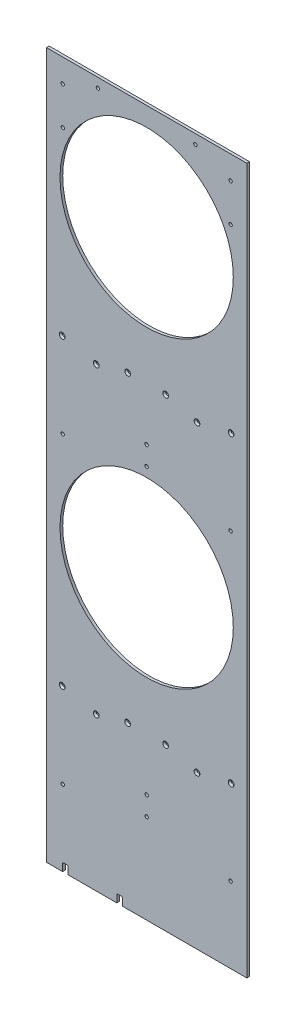
from build123d import *

# Parameters (mm, degrees)
SKETCH1_W                                     = 469.9
SKETCH1_H                                     = 2413
SKETCH1_R                                     = 203.2
BOSS_EXTRUDE1_DEPTH                           = 6.35
CSK_FOR_1_4_FLAT_HEAD_SOCKET_CAP_SCR_2_COUNT  = 2
CSK_FOR_1_4_FLAT_HEAD_SOCKET_CAP_SCR_2_PITCH  = 76.2
CSK_FOR_1_4_FLAT_HEAD_SOCKET_CAP_SCR_3_COUNT  = 2
CSK_FOR_1_4_FLAT_HEAD_SOCKET_CAP_SCR_3_PITCH  = 89.142542345
CSK_FOR_1_4_FLAT_HEAD_SOCKET_CAP_SCR_4_COUNT  = 2
CSK_FOR_1_4_FLAT_HEAD_SOCKET_CAP_SCR_4_PITCH  = 163.936718394
CSK_FOR_1_4_FLAT_HEAD_SOCKET_CAP_SCR_5_COUNT  = 2
CSK_FOR_1_4_FLAT_HEAD_SOCKET_CAP_SCR_5_PITCH  = 711.2
CSK_FOR_1_4_FLAT_HEAD_SOCKET_CAP_SCR_6_COUNT  = 2
CSK_FOR_1_4_FLAT_HEAD_SOCKET_CAP_SCR_6_PITCH  = 695.384275934
CSK_FOR_1_4_FLAT_HEAD_SOCKET_CAP_SCR_7_COUNT  = 2
CSK_FOR_1_4_FLAT_HEAD_SOCKET_CAP_SCR_7_PITCH  = 716.764837904
CSK_FOR_1_4_FLAT_HEAD_SOCKET_CAP_SCR_8_COUNT  = 2
CSK_FOR_1_4_FLAT_HEAD_SOCKET_CAP_SCR_8_PITCH  = 710.371803251
CSK_FOR_1_4_FLAT_HEAD_SOCKET_CAP_SCR_9_COUNT  = 2
CSK_FOR_1_4_FLAT_HEAD_SOCKET_CAP_SCR_9_PITCH  = 1422.4
CSK_FOR_1_4_FLAT_HEAD_SOCKET_CAP_SCR_10_COUNT = 2
CSK_FOR_1_4_FLAT_HEAD_SOCKET_CAP_SCR_10_PITCH = 1404.60778242
CSK_FOR_1_4_FLAT_HEAD_SOCKET_CAP_SCR_11_COUNT = 2
CSK_FOR_1_4_FLAT_HEAD_SOCKET_CAP_SCR_11_PITCH = 1425.190567207
CSK_FOR_1_4_FLAT_HEAD_SOCKET_CAP_SCR_12_COUNT = 2
CSK_FOR_1_4_FLAT_HEAD_SOCKET_CAP_SCR_12_PITCH = 1412.087755797
CSK_FOR_1_4_FLAT_HEAD_SOCKET_CAP_SCR_13_COUNT = 2
CSK_FOR_1_4_FLAT_HEAD_SOCKET_CAP_SCR_13_PITCH = 153.55813077
CSK_FOR_1_4_FLAT_HEAD_SOCKET_CAP_SCR_14_COUNT = 2
CSK_FOR_1_4_FLAT_HEAD_SOCKET_CAP_SCR_14_PITCH = 242.697219812
CSK_FOR_1_4_FLAT_HEAD_SOCKET_CAP_SCR_15_COUNT = 2
CSK_FOR_1_4_FLAT_HEAD_SOCKET_CAP_SCR_15_PITCH = 749.86024568
CSK_FOR_1_4_FLAT_HEAD_SOCKET_CAP_SCR_16_COUNT = 2
CSK_FOR_1_4_FLAT_HEAD_SOCKET_CAP_SCR_16_PITCH = 1441.280581843
CSK_FOR_1_4_FLAT_HEAD_SOCKET_CAP_SCR_17_COUNT = 2
CSK_FOR_1_4_FLAT_HEAD_SOCKET_CAP_SCR_17_PITCH = 1428.974413563
CSK_FOR_1_4_FLAT_HEAD_SOCKET_CAP_SCR_18_COUNT = 2
CSK_FOR_1_4_FLAT_HEAD_SOCKET_CAP_SCR_18_PITCH = 725.925992834
F_5_16_0_3125_DIAMETER_HOLE1_D                = 7.9375
SKETCH6_W                                     = 469.9
SKETCH6_H                                     = 758.19
CUT_EXTRUDE1_DEPTH                            = 2425.419688297
SKETCH8_W                                     = 13.208
SKETCH8_H                                     = 19.05
CUT_EXTRUDE2_DEPTH                            = 1672.417949257
FILLET1_R                                     = 3.175


with BuildPart() as part:
    # Sketch1 → Boss-Extrude1 (new body)
    with BuildSketch(Plane.XY):
        with Locations((0, 1206.5)):
            Rectangle(SKETCH1_W, SKETCH1_H)
        with Locations((0, 695.96)):
            Circle(SKETCH1_R, mode=Mode.SUBTRACT)
        with Locations((0, 1407.16)):
            Circle(SKETCH1_R, mode=Mode.SUBTRACT)
        with Locations((0, 2118.36)):
            Circle(SKETCH1_R, mode=Mode.SUBTRACT)
    extrude(amount=BOSS_EXTRUDE1_DEPTH)

    # Sketch3 → CSK for 1/4 Flat Head Socket Cap Screw1 (revolve, cut)
    with BuildSketch(Plane(origin=(44.571271172, 378.545152647, 6.35), x_dir=(0, -1, 0), z_dir=(1, 0, 0))):
        Polygon((0, 0), (0, 6.35), (3.3782, 6.35), (3.3782, 3.871564875), (6.7437, 0), align=None)
    csk_for_1_4_flat_head_socket_cap_screw1 = revolve(axis=Axis((44.571271172, 378.545152647, 12.7), (0, 0, -1)), mode=Mode.SUBTRACT)

    # CSK for 1_4 Flat Head Socket Cap Scr 2: CSK for 1/4 Flat Head Socket Cap Screw1 ×2
    with Locations(*[Vector(0.9659258262890683, -0.2588190451025208, 0) * (i * CSK_FOR_1_4_FLAT_HEAD_SOCKET_CAP_SCR_2_PITCH) for i in range(1, CSK_FOR_1_4_FLAT_HEAD_SOCKET_CAP_SCR_2_COUNT)]):
        add(csk_for_1_4_flat_head_socket_cap_screw1, mode=Mode.SUBTRACT)

    # CSK for 1_4 Flat Head Socket Cap Scr 3: CSK for 1/4 Flat Head Socket Cap Screw1 ×2
    with Locations(*[(-i * CSK_FOR_1_4_FLAT_HEAD_SOCKET_CAP_SCR_3_PITCH, 0, 0) for i in range(1, CSK_FOR_1_4_FLAT_HEAD_SOCKET_CAP_SCR_3_COUNT)]):
        add(csk_for_1_4_flat_head_socket_cap_screw1, mode=Mode.SUBTRACT)

    # CSK for 1_4 Flat Head Socket Cap Scr 4: CSK for 1/4 Flat Head Socket Cap Screw1 ×2
    with Locations(*[Vector(-0.9927372702249053, -0.12030258644935032, 0) * (i * CSK_FOR_1_4_FLAT_HEAD_SOCKET_CAP_SCR_4_PITCH) for i in range(1, CSK_FOR_1_4_FLAT_HEAD_SOCKET_CAP_SCR_4_COUNT)]):
        add(csk_for_1_4_flat_head_socket_cap_screw1, mode=Mode.SUBTRACT)

    # CSK for 1_4 Flat Head Socket Cap Scr 5: CSK for 1/4 Flat Head Socket Cap Screw1 ×2
    with Locations(*[(0, i * CSK_FOR_1_4_FLAT_HEAD_SOCKET_CAP_SCR_5_PITCH, 0) for i in range(1, CSK_FOR_1_4_FLAT_HEAD_SOCKET_CAP_SCR_5_COUNT)]):
        add(csk_for_1_4_flat_head_socket_cap_screw1, mode=Mode.SUBTRACT)

    # CSK for 1_4 Flat Head Socket Cap Scr 6: CSK for 1/4 Flat Head Socket Cap Screw1 ×2
    with Locations(*[Vector(0.10584586179249755, 0.9943825488922277, 0) * (i * CSK_FOR_1_4_FLAT_HEAD_SOCKET_CAP_SCR_6_PITCH) for i in range(1, CSK_FOR_1_4_FLAT_HEAD_SOCKET_CAP_SCR_6_COUNT)]):
        add(csk_for_1_4_flat_head_socket_cap_screw1, mode=Mode.SUBTRACT)

    # CSK for 1_4 Flat Head Socket Cap Scr 7: CSK for 1/4 Flat Head Socket Cap Screw1 ×2
    with Locations(*[Vector(-0.12436790650262035, 0.9922361734144526, 0) * (i * CSK_FOR_1_4_FLAT_HEAD_SOCKET_CAP_SCR_7_PITCH) for i in range(1, CSK_FOR_1_4_FLAT_HEAD_SOCKET_CAP_SCR_7_COUNT)]):
        add(csk_for_1_4_flat_head_socket_cap_screw1, mode=Mode.SUBTRACT)

    # CSK for 1_4 Flat Head Socket Cap Scr 8: CSK for 1/4 Flat Head Socket Cap Screw1 ×2
    with Locations(*[Vector(-0.22909987356363595, 0.9734029216789553, 0) * (i * CSK_FOR_1_4_FLAT_HEAD_SOCKET_CAP_SCR_8_PITCH) for i in range(1, CSK_FOR_1_4_FLAT_HEAD_SOCKET_CAP_SCR_8_COUNT)]):
        add(csk_for_1_4_flat_head_socket_cap_screw1, mode=Mode.SUBTRACT)

    # CSK for 1_4 Flat Head Socket Cap Scr 9: CSK for 1/4 Flat Head Socket Cap Screw1 ×2
    with Locations(*[(0, i * CSK_FOR_1_4_FLAT_HEAD_SOCKET_CAP_SCR_9_PITCH, 0) for i in range(1, CSK_FOR_1_4_FLAT_HEAD_SOCKET_CAP_SCR_9_COUNT)]):
        add(csk_for_1_4_flat_head_socket_cap_screw1, mode=Mode.SUBTRACT)

    # CSK for 1_4 Flat Head Socket Cap Scr 10: CSK for 1/4 Flat Head Socket Cap Screw1 ×2
    with Locations(*[Vector(0.05240149519635648, 0.9986260978470302, 0) * (i * CSK_FOR_1_4_FLAT_HEAD_SOCKET_CAP_SCR_10_PITCH) for i in range(1, CSK_FOR_1_4_FLAT_HEAD_SOCKET_CAP_SCR_10_COUNT)]):
        add(csk_for_1_4_flat_head_socket_cap_screw1, mode=Mode.SUBTRACT)

    # CSK for 1_4 Flat Head Socket Cap Scr 11: CSK for 1/4 Flat Head Socket Cap Screw1 ×2
    with Locations(*[Vector(-0.06254780546262285, 0.9980419690733501, 0) * (i * CSK_FOR_1_4_FLAT_HEAD_SOCKET_CAP_SCR_11_PITCH) for i in range(1, CSK_FOR_1_4_FLAT_HEAD_SOCKET_CAP_SCR_11_COUNT)]):
        add(csk_for_1_4_flat_head_socket_cap_screw1, mode=Mode.SUBTRACT)

    # CSK for 1_4 Flat Head Socket Cap Scr 12: CSK for 1/4 Flat Head Socket Cap Screw1 ×2
    with Locations(*[Vector(-0.11525210783816901, 0.9933362731919434, 0) * (i * CSK_FOR_1_4_FLAT_HEAD_SOCKET_CAP_SCR_12_PITCH) for i in range(1, CSK_FOR_1_4_FLAT_HEAD_SOCKET_CAP_SCR_12_COUNT)]):
        add(csk_for_1_4_flat_head_socket_cap_screw1, mode=Mode.SUBTRACT)

    # CSK for 1_4 Flat Head Socket Cap Scr 13: CSK for 1/4 Flat Head Socket Cap Screw1 ×2
    with Locations(*[Vector(0.9999387727480229, -0.01106574693266877, 0) * (i * CSK_FOR_1_4_FLAT_HEAD_SOCKET_CAP_SCR_13_PITCH) for i in range(1, CSK_FOR_1_4_FLAT_HEAD_SOCKET_CAP_SCR_13_COUNT)]):
        add(csk_for_1_4_flat_head_socket_cap_screw1, mode=Mode.SUBTRACT)

    # CSK for 1_4 Flat Head Socket Cap Scr 14: CSK for 1/4 Flat Head Socket Cap Screw1 ×2
    with Locations(*[Vector(-0.9999754894630325, -0.007001462216473419, 0) * (i * CSK_FOR_1_4_FLAT_HEAD_SOCKET_CAP_SCR_14_PITCH) for i in range(1, CSK_FOR_1_4_FLAT_HEAD_SOCKET_CAP_SCR_14_COUNT)]):
        add(csk_for_1_4_flat_head_socket_cap_screw1, mode=Mode.SUBTRACT)

    # CSK for 1_4 Flat Head Socket Cap Scr 15: CSK for 1/4 Flat Head Socket Cap Screw1 ×2
    with Locations(*[Vector(-0.3236486699631256, 0.9461773292734824, 0) * (i * CSK_FOR_1_4_FLAT_HEAD_SOCKET_CAP_SCR_15_PITCH) for i in range(1, CSK_FOR_1_4_FLAT_HEAD_SOCKET_CAP_SCR_15_COUNT)]):
        add(csk_for_1_4_flat_head_socket_cap_screw1, mode=Mode.SUBTRACT)

    # CSK for 1_4 Flat Head Socket Cap Scr 16: CSK for 1/4 Flat Head Socket Cap Screw1 ×2
    with Locations(*[Vector(-0.16838586062272745, 0.9857211583111846, 0) * (i * CSK_FOR_1_4_FLAT_HEAD_SOCKET_CAP_SCR_16_PITCH) for i in range(1, CSK_FOR_1_4_FLAT_HEAD_SOCKET_CAP_SCR_16_COUNT)]):
        add(csk_for_1_4_flat_head_socket_cap_screw1, mode=Mode.SUBTRACT)

    # CSK for 1_4 Flat Head Socket Cap Scr 17: CSK for 1/4 Flat Head Socket Cap Screw1 ×2
    with Locations(*[Vector(0.10745379859161856, 0.9942100789914735, 0) * (i * CSK_FOR_1_4_FLAT_HEAD_SOCKET_CAP_SCR_17_PITCH) for i in range(1, CSK_FOR_1_4_FLAT_HEAD_SOCKET_CAP_SCR_17_COUNT)]):
        add(csk_for_1_4_flat_head_socket_cap_screw1, mode=Mode.SUBTRACT)

    # CSK for 1_4 Flat Head Socket Cap Scr 18: CSK for 1/4 Flat Head Socket Cap Screw1 ×2
    with Locations(*[Vector(0.21152118858309418, 0.9773734121513615, 0) * (i * CSK_FOR_1_4_FLAT_HEAD_SOCKET_CAP_SCR_18_PITCH) for i in range(1, CSK_FOR_1_4_FLAT_HEAD_SOCKET_CAP_SCR_18_COUNT)]):
        add(csk_for_1_4_flat_head_socket_cap_screw1, mode=Mode.SUBTRACT)

    # 5/16 (0.3125) Diameter Hole1 (through all)
    with Locations(Plane.XY.offset(6.35)):
        with Locations((0, 254.635), (0, 210.185), (-196.85, 177.8), (196.85, 177.8), (0, 965.835), (0, 921.385), (-196.85, 889), (196.85, 889), (-196.85, 1600.2), (196.85, 1600.2), (-114.3, 1632.585), (-114.3, 1677.035), (114.3, 1677.035), (114.3, 1632.585), (196.85, 1511.3), (-196.85, 1511.3)):
            Hole(F_5_16_0_3125_DIAMETER_HOLE1_D / 2)

    # Sketch6 → Cut-Extrude1 (cut, through all)
    with BuildSketch(Plane.XY.offset(6.35)):
        with Locations((0, 2033.905)):
            Rectangle(SKETCH6_W, SKETCH6_H)
    extrude(amount=-CUT_EXTRUDE1_DEPTH, mode=Mode.SUBTRACT)

    # Sketch8 → Cut-Extrude2 (cut, through all)
    with BuildSketch(Plane.XY.offset(6.35)):
        with Locations((-63.5, 9.525)):
            Rectangle(SKETCH8_W, SKETCH8_H)
        with Locations((-190.5, 9.525)):
            Rectangle(SKETCH8_W, SKETCH8_H)
    extrude(amount=-CUT_EXTRUDE2_DEPTH, mode=Mode.SUBTRACT)

    # Fillet1
    fillet1_edges = [part.edges().sort_by_distance(p)[0] for p in [
        (-70.104, 19.05, 3.175),
        (-56.896, 19.05, 3.175),
        (-197.104, 19.05, 3.175),
        (-183.896, 19.05, 3.175),
    ]]
    fillet(fillet1_edges, radius=FILLET1_R)


solid = part.part
